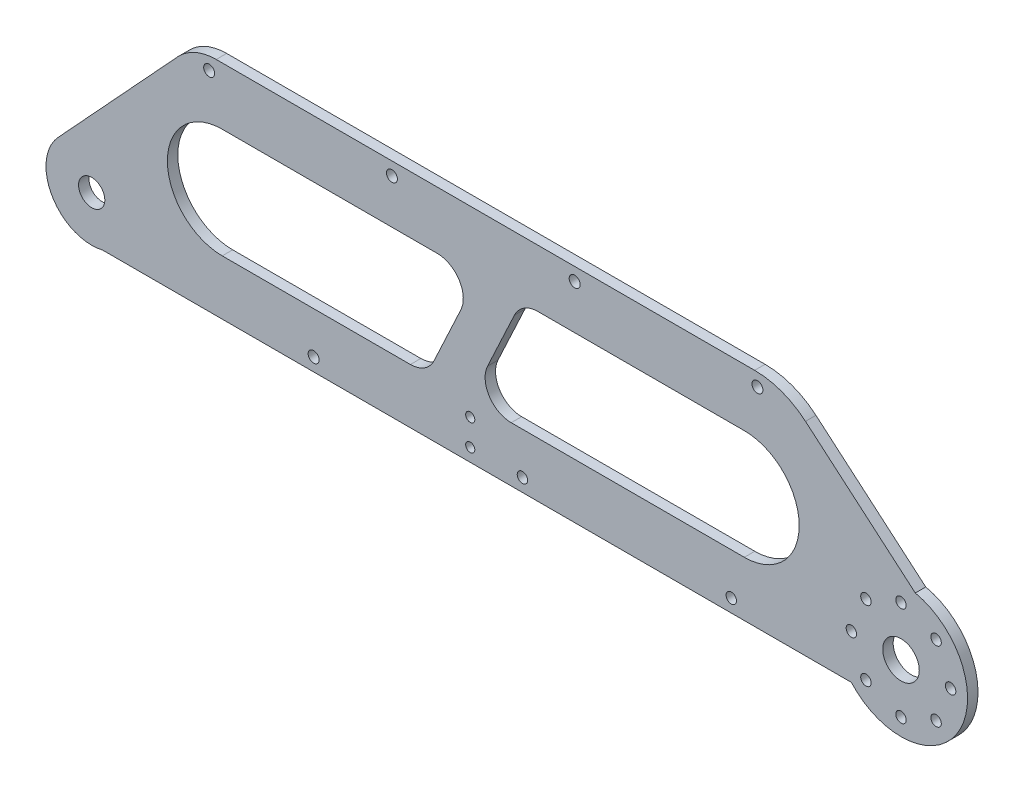
from build123d import *

# Parameters (mm, degrees)
SKETCH_2_R      = 2.1
SKETCH_2_R_2    = 1.75
SKETCH_2_R_3    = 5.03
SKETCH_2_R_4    = 2
SKETCH_2_R_5    = 7
EXTRUDE_1_DEPTH = 4


with BuildPart() as part:
    # 草图2 → 凸台-拉伸1 (new body)
    with BuildSketch(Plane.XY):
        with BuildLine():
            Line((-56.063767215, 68), (-262.305181408, 68))
            ThreePointArc((-262.305181408, 68), (-270.328158767, 66.320257484), (-277.003482509, 61.56318343))
            Line((-277.003482509, 61.56318343), (-322.861013463, 11.867785501))
            ThreePointArc((-322.861013463, 11.867785501), (-325.076248752, -8.885759595), (-305.846688069, -17))
            Line((-305.846688069, -17), (-19.006577809, -17))
            ThreePointArc((-19.006577809, -17), (22.016096561, -12.86629287), (5.482131266, 24.903739414))
            Line((5.482131266, 24.903739414), (-36.585436121, 60.816542635))
            ThreePointArc((-36.585436121, 60.816542635), (-45.683407853, 66.146902841), (-56.063767215, 68))
        make_face()
        with Locations((-225, -12)):
            Circle(SKETCH_2_R, mode=Mode.SUBTRACT)
        with Locations((-165, -12)):
            Circle(SKETCH_2_R_2, mode=Mode.SUBTRACT)
        with Locations((-310, 0)):
            Circle(SKETCH_2_R_3, mode=Mode.SUBTRACT)
        with Locations((-165, -2)):
            Circle(SKETCH_2_R_2, mode=Mode.SUBTRACT)
        with Locations((-145, -12)):
            Circle(SKETCH_2_R_4, mode=Mode.SUBTRACT)
        with Locations((-65, -12)):
            Circle(SKETCH_2_R_4, mode=Mode.SUBTRACT)
        with Locations((0, -19)):
            Circle(SKETCH_2_R_4, mode=Mode.SUBTRACT)
        with Locations((-13.435028843, -13.435028843)):
            Circle(SKETCH_2_R_4, mode=Mode.SUBTRACT)
        with Locations((13.435028843, -13.435028843)):
            Circle(SKETCH_2_R_4, mode=Mode.SUBTRACT)
        with Locations((-19, 0)):
            Circle(SKETCH_2_R_4, mode=Mode.SUBTRACT)
        Circle(SKETCH_2_R_5, mode=Mode.SUBTRACT)
        with Locations((19, 0)):
            Circle(SKETCH_2_R_4, mode=Mode.SUBTRACT)
        with Locations((-13.435028843, 13.435028843)):
            Circle(SKETCH_2_R_4, mode=Mode.SUBTRACT)
        with Locations((13.435028843, 13.435028843)):
            Circle(SKETCH_2_R_4, mode=Mode.SUBTRACT)
        with Locations((0, 19)):
            Circle(SKETCH_2_R_4, mode=Mode.SUBTRACT)
        with BuildLine():
            Line((-168.599525043, 31.773817383), (-178.858293522, 9.773817383))
            ThreePointArc((-178.858293522, 9.773817383), (-182.548375309, 5.566085542), (-187.921371393, 4))
            Line((-187.921371393, 4), (-260, 4))
            ThreePointArc((-260, 4), (-281, 25), (-260, 46))
            Line((-260, 46), (-177.662602913, 46))
            ThreePointArc((-177.662602913, 46), (-169.228688455, 41.372996083), (-168.599525043, 31.773817383))
        make_face(mode=Mode.SUBTRACT)
        with Locations((-265, 63)):
            Circle(SKETCH_2_R, mode=Mode.SUBTRACT)
        with Locations((-195, 63)):
            Circle(SKETCH_2_R, mode=Mode.SUBTRACT)
        with BuildLine():
            Line((-60, 4), (-149.303144229, 4))
            ThreePointArc((-149.303144229, 4), (-157.737058687, 8.627003917), (-158.366222099, 18.226182617))
            Line((-158.366222099, 18.226182617), (-148.10745362, 40.226182617))
            ThreePointArc((-148.10745362, 40.226182617), (-144.417371833, 44.433914458), (-139.044375749, 46))
            Line((-139.044375749, 46), (-60, 46))
            ThreePointArc((-60, 46), (-39, 25), (-60, 4))
        make_face(mode=Mode.SUBTRACT)
        with Locations((-125, 63)):
            Circle(SKETCH_2_R, mode=Mode.SUBTRACT)
        with Locations((-55, 63)):
            Circle(SKETCH_2_R, mode=Mode.SUBTRACT)
    extrude(amount=EXTRUDE_1_DEPTH)


solid = part.part
